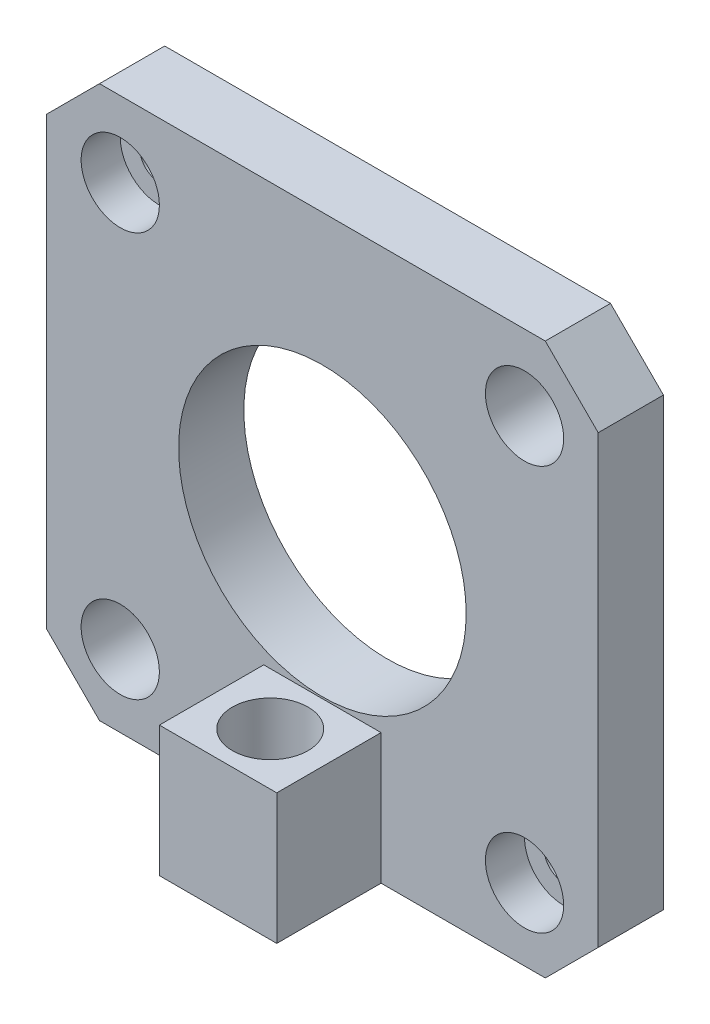
from build123d import *

# Parameters (mm, degrees)
SKETCH1_R           = 11025
BOSS_EXTRUDE1_DEPTH = 5000
BOSS_EXTRUDE2_DEPTH = 8000
SKETCH4_R           = 3000
CUT_EXTRUDE2_DEPTH  = 3000
SKETCH5_R           = 1500
CUT_EXTRUDE3_DEPTH  = 3000
SKETCH6_R           = 3000
CUT_EXTRUDE4_DEPTH  = 3000
SKETCH3_R           = 2900
CUT_EXTRUDE1_DEPTH  = 12018
SCALE6_SCALE        = 0.001


with BuildPart() as part:
    # Sketch1 → Boss-Extrude1 (new body)
    with BuildSketch(Plane.XY):
        Polygon((-21150, 17212.99935917), (-17091.781053823, 21271.218305346), (17091.781053823, 21271.218305346), (21150, 17212.99935917), (21150, -16970.562748477), (17091.781053823, -21028.781694654), (-17091.781053823, -21028.781694654), (-21150, -16970.562748477), align=None)
        with Locations((0, 121.218305346)):
            Circle(SKETCH1_R, mode=Mode.SUBTRACT)
    extrude(amount=BOSS_EXTRUDE1_DEPTH)

    # Sketch2 → Boss-Extrude2 (add)
    with BuildSketch(Plane.XY.offset(5000)):
        Polygon((0, -11028.781694654), (4500, -11028.781694654), (4500, -21028.781694654), (-4500, -21028.781694654), (-4500, -11028.781694654), align=None)
    extrude(amount=BOSS_EXTRUDE2_DEPTH)

    # Sketch4 → Cut-Extrude2 (cut)
    with BuildSketch(Plane.XY.offset(5000)):
        with Locations((-15500, 15500)):
            Circle(SKETCH4_R)
        with Locations((15500, 15500)):
            Circle(SKETCH4_R)
        with Locations((15500, -15500)):
            Circle(SKETCH4_R)
        with Locations((-15500, -15500)):
            Circle(SKETCH4_R)
    extrude(amount=-CUT_EXTRUDE2_DEPTH, mode=Mode.SUBTRACT)

    # Sketch5 → Cut-Extrude3 (cut)
    with BuildSketch(Plane.XY.offset(2000)):
        with Locations((-15500, 15500)):
            Circle(SKETCH5_R)
        with Locations((15500, -15500)):
            Circle(SKETCH5_R)
    extrude(amount=-CUT_EXTRUDE3_DEPTH, mode=Mode.SUBTRACT)

    # Sketch6 → Cut-Extrude4 (cut)
    with BuildSketch(Plane.XY.offset(2000)):
        with Locations((15500, 15500)):
            Circle(SKETCH6_R)
        with Locations((-15500, -15500)):
            Circle(SKETCH6_R)
    extrude(amount=-CUT_EXTRUDE4_DEPTH, mode=Mode.SUBTRACT)

    # Sketch3 → Cut-Extrude1 (cut)
    with BuildSketch(Plane.XZ.offset(21028.781694654)):
        with Locations(Location((0, 9000, 0), (0, 0, 270))):
            Circle(SKETCH3_R)
    extrude(amount=-CUT_EXTRUDE1_DEPTH, mode=Mode.SUBTRACT)


with BuildPart() as part_1:
    # Scale6: scaled about (0, -945.258123271, 2914.075668663)
    add(part.part.scale(SCALE6_SCALE).moved(Location((0, -944.312865148, 2911.161592994))))


solid = part_1.part
